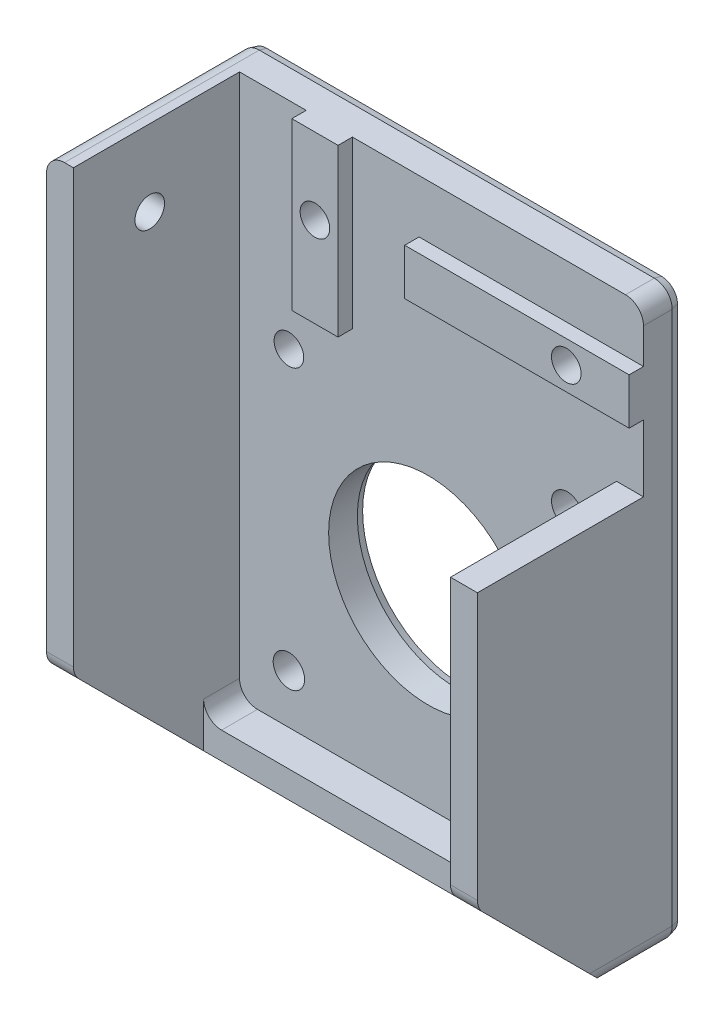
from build123d import *
from OCP.BRepFilletAPI import BRepFilletAPI_MakeChamfer

# Parameters (mm, degrees)
SKETCH1_R                  = 1.75
SKETCH1_R_2                = 11.075
SKETCH1_R_3                = 1.65
EXTRUDE1_DEPTH             = 4
SKETCH_W                   = 3
SKETCH_H                   = 63.5
SKETCH_H_2                 = 45
EXTRUDE2_DEPTH             = 22.5
SKETCH_2_W                 = 42
SKETCH_2_H                 = 3
EXTRUDE3_DEPTH             = 8
EXTRUDE4_REACH             = 65.965
EXTRUDE4_DIRECTION_2_REACH = 65.965
FILLET1_R                  = 2
EXTRUDE5_REACH             = 65.965
SKETCH3_R                  = 1.65
SKETCH_3_W                 = 5.15
SKETCH_3_H                 = 18.5
SKETCH_3_R                 = 1.65
SKETCH_3_W_2               = 25
SKETCH_3_H_2               = 5.15
EXTRUDE7_DEPTH             = 1.6
CHAMFER1_SIZE              = 0.8
CHAMFER1_SIZE2             = 0.214359354


with BuildPart() as part:
    # Sketch1 → Extrude1 (new body)
    with BuildSketch(Plane.XY):
        Polygon((-21, 39.5), (-21, -21), (21, -21), (21, 21), (24, 21), (24, 39.5), align=None)
        with Locations((-15.5, -15.5)):
            Circle(SKETCH1_R, mode=Mode.SUBTRACT)
        Circle(SKETCH1_R_2, mode=Mode.SUBTRACT)
        with Locations((15.5, -15.5)):
            Circle(SKETCH1_R, mode=Mode.SUBTRACT)
        with Locations((-15.5, 15.5)):
            Circle(SKETCH1_R_3, mode=Mode.SUBTRACT)
        with Locations((-11, 31)):
            Circle(SKETCH1_R_3, mode=Mode.SUBTRACT)
        with Locations((15.5, 15.5)):
            Circle(SKETCH1_R, mode=Mode.SUBTRACT)
        with Locations((17, 31)):
            Circle(SKETCH1_R_3, mode=Mode.SUBTRACT)
    extrude(amount=EXTRUDE1_DEPTH)

    # Sketch → Extrude2 (add)
    with BuildSketch(Plane.XY):
        with Locations((-22.5, 7.75)):
            Rectangle(SKETCH_W, SKETCH_H)
        with Locations((22.5, -1.5)):
            Rectangle(SKETCH_W, SKETCH_H_2)
    extrude(amount=EXTRUDE2_DEPTH)

    # Sketch 2 → Extrude3 (add)
    with BuildSketch(Plane.XY):
        with Locations((0, -22.5)):
            Rectangle(SKETCH_2_W, SKETCH_2_H)
    extrude(amount=EXTRUDE3_DEPTH)

    # Sketch2 → Extrude4 (cut, up to next)
    with BuildSketch(Plane(origin=(-21, 0, 0), x_dir=(0, 0, -1), z_dir=(1, 0, 0)), mode=Mode.PRIVATE) as extrude4_sk1:
        Polygon((-8, -24), (-22.5, -9.5), (-22.5, -24), align=None)
    extrude4_tool1 = extrude(extrude4_sk1.sketch, amount=-EXTRUDE4_REACH, mode=Mode.PRIVATE) & part.part
    add(extrude4_tool1.solids().sort_by_distance((-21, -19.166667, 17.666667))[0], mode=Mode.SUBTRACT)

    # Sketch2 → Extrude4 direction 2 (cut, up to next)
    with BuildSketch(Plane(origin=(-21, 0, 0), x_dir=(0, 0, -1), z_dir=(1, 0, 0)), mode=Mode.PRIVATE) as extrude4_direction_2_sk1:
        Polygon((-8, -24), (-22.5, -9.5), (-22.5, -24), align=None)
    extrude4_direction_2_tool1 = extrude(extrude4_direction_2_sk1.sketch, amount=EXTRUDE4_DIRECTION_2_REACH, mode=Mode.PRIVATE) & part.part
    add(extrude4_direction_2_tool1.solids().sort_by_distance((-21, -19.166667, 17.666667))[0], mode=Mode.SUBTRACT)

    # Fillet1
    fillet1_edges = [part.edges().sort_by_distance(p)[0] for p in [
        (22.5, -9.5, 22.5),
        (-22.5, -9.5, 22.5),
        (24, -24, 4),
        (-24, -24, 4),
        (-24, 39.5, 11.25),
        (24, 39.5, 2),
        (21, -21, 6),
        (-21, -21, 6),
    ]]
    fillet(fillet1_edges, radius=FILLET1_R)

    # Sketch3 → Extrude5 (cut, up to next)
    with BuildSketch(Plane(origin=(-21, 0, 0), x_dir=(0, 0, -1), z_dir=(1, 0, 0)), mode=Mode.PRIVATE) as extrude5_sk1:
        with Locations((-14, 31)):
            Circle(SKETCH3_R)
    extrude5_tool1 = extrude(extrude5_sk1.sketch, amount=-EXTRUDE5_REACH, mode=Mode.PRIVATE) & part.part
    add(extrude5_tool1.solids().sort_by_distance((-21, 31, 14))[0], mode=Mode.SUBTRACT)

    # Sketch 3 → Extrude7 (add)
    # profile 1 of 2: a face of its own
    with BuildSketch(Plane.XY.offset(4)):
        with Locations((-11, 30.25)):
            Rectangle(SKETCH_3_W, SKETCH_3_H)
        with Locations((-11, 31)):
            Circle(SKETCH_3_R, mode=Mode.SUBTRACT)
    # profile 2 of 2: a face of its own
    with BuildSketch(Plane.XY.offset(4)):
        with Locations((11.5, 31)):
            Rectangle(SKETCH_3_W_2, SKETCH_3_H_2)
        with Locations((17, 31)):
            Circle(SKETCH_3_R, mode=Mode.SUBTRACT)
    extrude(amount=EXTRUDE7_DEPTH)

    # Chamfer1: one chamfer whose edges measure the first distance from different faces: ONE call of the kernel's chamfer builder (chamfer() names one face for all edges)
    chamfer1_edges_1 = [part.edges().sort_by_distance(p)[0] for p in [
        (13.75, -15.5, 0),
    ]]
    chamfer1_side_1 = [part.faces().sort_by_distance(p)[0] for p in [
        (13.75, -15.5, 2),
    ]]
    chamfer1_edges_2 = [part.edges().sort_by_distance(p)[0] for p in [
        (-11.075, 0, 0),
    ]]
    chamfer1_side_2 = [part.faces().sort_by_distance(p)[0] for p in [
        (-11.075, 0, 2),
    ]]
    chamfer1_edges_3 = [part.edges().sort_by_distance(p)[0] for p in [
        (-17.25, -15.5, 0),
    ]]
    chamfer1_side_3 = [part.faces().sort_by_distance(p)[0] for p in [
        (-17.25, -15.5, 2),
    ]]
    chamfer1_edges_4 = [part.edges().sort_by_distance(p)[0] for p in [
        (-17.15, 15.5, 0),
    ]]
    chamfer1_side_4 = [part.faces().sort_by_distance(p)[0] for p in [
        (-17.15, 15.5, 2),
    ]]
    chamfer1_edges_5 = [part.edges().sort_by_distance(p)[0] for p in [
        (-12.65, 31, 0),
    ]]
    chamfer1_side_5 = [part.faces().sort_by_distance(p)[0] for p in [
        (-12.65, 31, 2.8),
    ]]
    chamfer1_edges_6 = [part.edges().sort_by_distance(p)[0] for p in [
        (13.75, 15.5, 0),
    ]]
    chamfer1_side_6 = [part.faces().sort_by_distance(p)[0] for p in [
        (13.75, 15.5, 2),
    ]]
    chamfer1_edges_7 = [part.edges().sort_by_distance(p)[0] for p in [
        (15.35, 31, 0),
    ]]
    chamfer1_side_7 = [part.faces().sort_by_distance(p)[0] for p in [
        (15.35, 31, 2.8),
    ]]
    chamfer1_edges_8 = [part.edges().sort_by_distance(p)[0] for p in [
        (-23.414213562, -23.414213562, 0),
    ]]
    chamfer1_side_8 = [part.faces().sort_by_distance(p)[0] for p in [
        (-23.414213562, -23.414213562, 5),
    ]]
    chamfer1_edges_9 = [part.edges().sort_by_distance(p)[0] for p in [
        (-24, 7.75, 0),
    ]]
    chamfer1_side_9 = [part.faces().sort_by_distance(p)[0] for p in [
        (-24, 9.188771093, 10.788442167),
    ]]
    chamfer1_edges_10 = [part.edges().sort_by_distance(p)[0] for p in [
        (0, -24, 0),
    ]]
    chamfer1_side_10 = [part.faces().sort_by_distance(p)[0] for p in [
        (0, -24, 4),
    ]]
    chamfer1_edges_11 = [part.edges().sort_by_distance(p)[0] for p in [
        (-23.414213562, 38.914213562, 0),
    ]]
    chamfer1_side_11 = [part.faces().sort_by_distance(p)[0] for p in [
        (-23.414213562, 38.914213562, 11.25),
    ]]
    chamfer1_edges_12 = [part.edges().sort_by_distance(p)[0] for p in [
        (23.414213562, -23.414213562, 0),
    ]]
    chamfer1_side_12 = [part.faces().sort_by_distance(p)[0] for p in [
        (23.414213562, -23.414213562, 5),
    ]]
    chamfer1_edges_13 = [part.edges().sort_by_distance(p)[0] for p in [
        (0, 39.5, 0),
    ]]
    chamfer1_side_13 = [part.faces().sort_by_distance(p)[0] for p in [
        (-2.40894742, 39.5, 3.14036204),
    ]]
    chamfer1_edges_14 = [part.edges().sort_by_distance(p)[0] for p in [
        (24, 7.75, 0),
    ]]
    chamfer1_side_14 = [part.faces().sort_by_distance(p)[0] for p in [
        (24, 3.213429605, 9.985905939),
    ]]
    chamfer1_edges_15 = [part.edges().sort_by_distance(p)[0] for p in [
        (23.414213562, 38.914213562, 0),
    ]]
    chamfer1_side_15 = [part.faces().sort_by_distance(p)[0] for p in [
        (23.414213562, 38.914213562, 2),
    ]]
    chamfer1 = BRepFilletAPI_MakeChamfer(part.part.solid().wrapped)
    for e in chamfer1_edges_1:
        chamfer1.Add(CHAMFER1_SIZE, CHAMFER1_SIZE2, e.wrapped, chamfer1_side_1[0].wrapped)  # the first distance lies on this face
    for e in chamfer1_edges_2:
        chamfer1.Add(CHAMFER1_SIZE, CHAMFER1_SIZE2, e.wrapped, chamfer1_side_2[0].wrapped)  # the first distance lies on this face
    for e in chamfer1_edges_3:
        chamfer1.Add(CHAMFER1_SIZE, CHAMFER1_SIZE2, e.wrapped, chamfer1_side_3[0].wrapped)  # the first distance lies on this face
    for e in chamfer1_edges_4:
        chamfer1.Add(CHAMFER1_SIZE, CHAMFER1_SIZE2, e.wrapped, chamfer1_side_4[0].wrapped)  # the first distance lies on this face
    for e in chamfer1_edges_5:
        chamfer1.Add(CHAMFER1_SIZE, CHAMFER1_SIZE2, e.wrapped, chamfer1_side_5[0].wrapped)  # the first distance lies on this face
    for e in chamfer1_edges_6:
        chamfer1.Add(CHAMFER1_SIZE, CHAMFER1_SIZE2, e.wrapped, chamfer1_side_6[0].wrapped)  # the first distance lies on this face
    for e in chamfer1_edges_7:
        chamfer1.Add(CHAMFER1_SIZE, CHAMFER1_SIZE2, e.wrapped, chamfer1_side_7[0].wrapped)  # the first distance lies on this face
    for e in chamfer1_edges_8:
        chamfer1.Add(CHAMFER1_SIZE, CHAMFER1_SIZE2, e.wrapped, chamfer1_side_8[0].wrapped)  # the first distance lies on this face
    for e in chamfer1_edges_9:
        chamfer1.Add(CHAMFER1_SIZE, CHAMFER1_SIZE2, e.wrapped, chamfer1_side_9[0].wrapped)  # the first distance lies on this face
    for e in chamfer1_edges_10:
        chamfer1.Add(CHAMFER1_SIZE, CHAMFER1_SIZE2, e.wrapped, chamfer1_side_10[0].wrapped)  # the first distance lies on this face
    for e in chamfer1_edges_11:
        chamfer1.Add(CHAMFER1_SIZE, CHAMFER1_SIZE2, e.wrapped, chamfer1_side_11[0].wrapped)  # the first distance lies on this face
    for e in chamfer1_edges_12:
        chamfer1.Add(CHAMFER1_SIZE, CHAMFER1_SIZE2, e.wrapped, chamfer1_side_12[0].wrapped)  # the first distance lies on this face
    for e in chamfer1_edges_13:
        chamfer1.Add(CHAMFER1_SIZE, CHAMFER1_SIZE2, e.wrapped, chamfer1_side_13[0].wrapped)  # the first distance lies on this face
    for e in chamfer1_edges_14:
        chamfer1.Add(CHAMFER1_SIZE, CHAMFER1_SIZE2, e.wrapped, chamfer1_side_14[0].wrapped)  # the first distance lies on this face
    for e in chamfer1_edges_15:
        chamfer1.Add(CHAMFER1_SIZE, CHAMFER1_SIZE2, e.wrapped, chamfer1_side_15[0].wrapped)  # the first distance lies on this face
    add(Compound.cast(chamfer1.Shape()), mode=Mode.REPLACE)


solid = part.part
